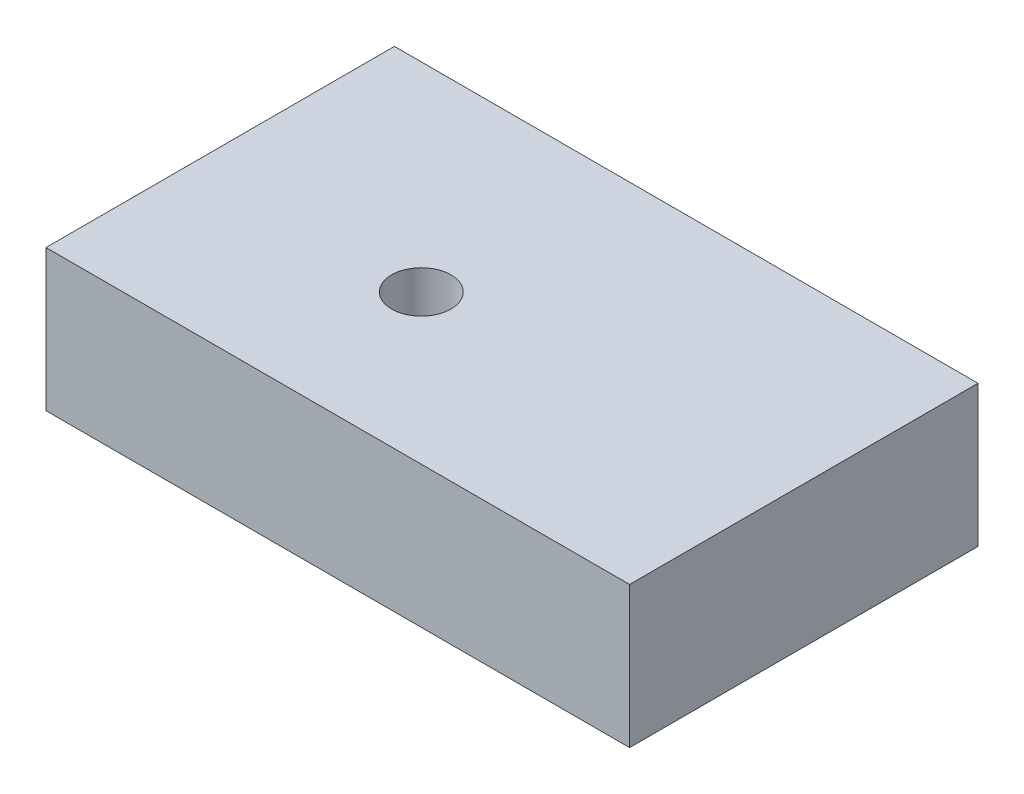
from build123d import *

# Parameters (mm, degrees)
SKETCH1_W                 = 41.295636026
SKETCH1_H                 = 24.657103064
BOSS_EXTRUDE1_DEPTH       = 10
M5X0_8_TAPPED_HOLE1_D     = 4.2
M5X0_8_TAPPED_HOLE1_DEPTH = 14
M5X0_8_TAPPED_HOLE1_TIP   = 1.2618073


with BuildPart() as part:
    # Sketch1 → Boss-Extrude1 (new body)
    with BuildSketch(Plane(origin=(0, 0, 0), x_dir=(1, 0, 0), z_dir=(0, 1, 0))):
        with Locations((1.60371402, 1.202785515)):
            Rectangle(SKETCH1_W, SKETCH1_H)
    extrude(amount=-BOSS_EXTRUDE1_DEPTH)

    # M5x0.8 Tapped Hole1
    with Locations(Plane(origin=(0, 0, 0), x_dir=(-1, 0, 0), z_dir=(0, 1, 0))):
        with Locations((3.044035574, 0.569159987)):
            Hole(M5X0_8_TAPPED_HOLE1_D / 2, depth=M5X0_8_TAPPED_HOLE1_DEPTH)
            with Locations((0, 0, -(M5X0_8_TAPPED_HOLE1_DEPTH + M5X0_8_TAPPED_HOLE1_TIP / 2))):  # 118° drill point
                Cone(0, M5X0_8_TAPPED_HOLE1_D / 2, M5X0_8_TAPPED_HOLE1_TIP, mode=Mode.SUBTRACT)


solid = part.part
